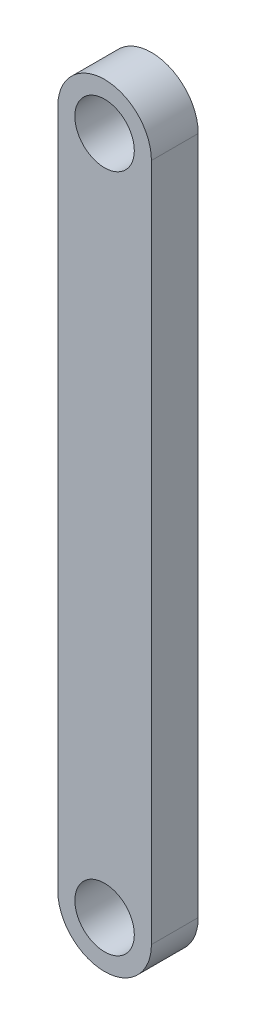
from build123d import *

# Parameters (mm, degrees)
BOSS_EXTRUDE1_DEPTH = 10
SKETCH2_R           = 6.35
CUT_EXTRUDE1_DEPTH  = 156.643824163


with BuildPart() as part:
    # Sketch1 → Boss-Extrude1 (new body)
    with BuildSketch(Plane.XY):
        with BuildLine():
            Line((-10, 0), (-10, 145))
            ThreePointArc((-10, 145), (0, 155), (10, 145))
            Line((10, 145), (10, 0))
            ThreePointArc((10, 0), (0, -10), (-10, 0))
        make_face()
    extrude(amount=BOSS_EXTRUDE1_DEPTH)

    # Sketch2 → Cut-Extrude1 (cut, through all)
    with BuildSketch(Plane.XY.offset(10)):
        with Locations((0, 145)):
            Circle(SKETCH2_R)
        Circle(SKETCH2_R)
    extrude(amount=-CUT_EXTRUDE1_DEPTH, mode=Mode.SUBTRACT)


solid = part.part
